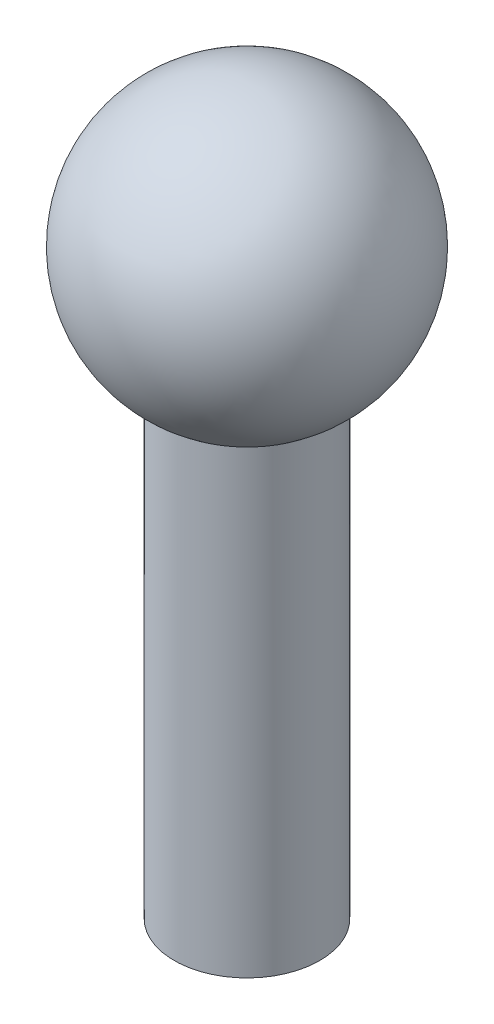
from build123d import *
from build123d.topology import SkipClean


with BuildPart() as part:
    # Sketch1 → Revolve1 (revolve)
    with SkipClean():  # the faces are left unmerged after this step: merging them gives an invalid solid
        with BuildSketch(Plane.XY):
            with BuildLine():
                ThreePointArc((-2, 12.651866191), (-1.037371232, 12.24049725), (0, 12.1))
                Line((0, 12.1), (0, 19.9))
                ThreePointArc((0, 19.9), (-3.75950275, 17.037371232), (-2, 12.651866191))
            make_face()
            with BuildLine():
                Line((0, 19.9), (0, 12.1))
                ThreePointArc((0, 12.1), (2.757716447, 13.242283553), (3.9, 16))
                ThreePointArc((3.9, 16), (2.757716447, 18.757716447), (0, 19.9))
            make_face()
            with BuildLine():
                Line((-2, 0), (0, 0))
                Line((0, 0), (0, 12.1))
                ThreePointArc((0, 12.1), (-1.037371232, 12.24049725), (-2, 12.651866191))
                Line((-2, 12.651866191), (-2, 0))
            make_face()
        revolve(axis=Axis((0, 0, 0), (0, 1, 0)))


solid = part.part
